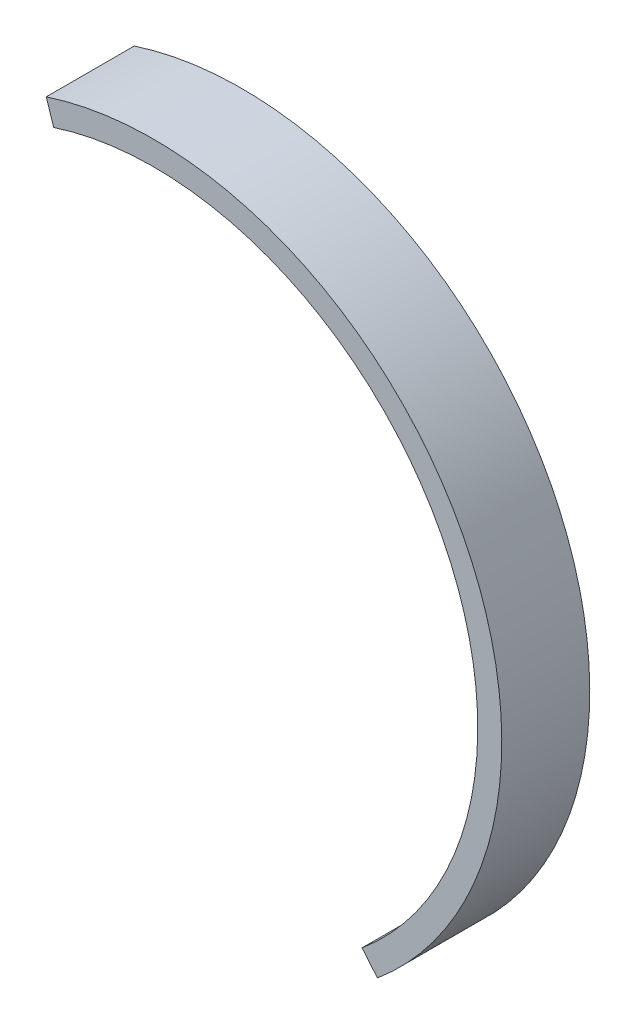
from build123d import *

# Parameters (mm, degrees)
BASE_EXTRUSION_DEPTH = 22


with BuildPart() as part:
    # Esquisse1 → Base-Extrusion (new body)
    with BuildSketch(Plane.XY):
        with BuildLine():
            Line((-25.030376544, 77.03557782), (-26.884478511, 82.741916918))
            ThreePointArc((-26.884478511, 82.741916918), (76.091914521, 42.178436961), (55.922522043, -66.645866551))
            Line((55.922522043, -66.645866551), (52.065796385, -62.049599893))
            ThreePointArc((52.065796385, -62.049599893), (70.844196278, 39.26957924), (-25.030376544, 77.03557782))
        make_face()
    extrude(amount=BASE_EXTRUSION_DEPTH)


solid = part.part
